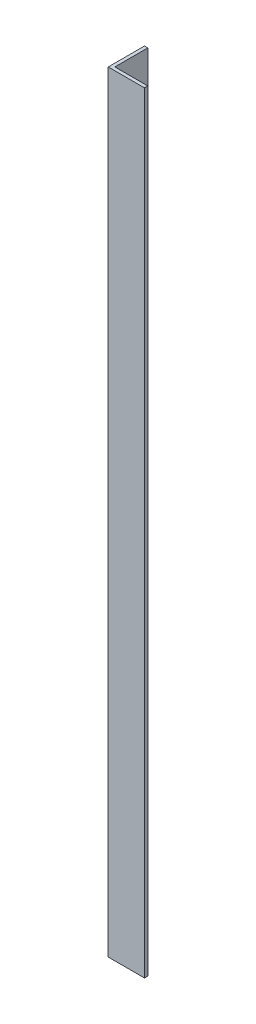
from build123d import *

# Parameters (mm, degrees)
EXTRUDE_START   = 40
EXTRUDE_1_DEPTH = 468


with BuildPart() as part:
    # Эскиз1 → Вытянуть1 (new body)
    with BuildSketch(Plane(origin=(0, 0, 0), x_dir=(1, 0, 0), z_dir=(0, 1, 0)).offset(EXTRUDE_START)):
        Polygon((0, -1.071873395), (0, -21.071873395), (20, -21.071873395), (20, -23.071873395), (-2, -23.071873395), (-2, -1.071873395), align=None)
    extrude(amount=EXTRUDE_1_DEPTH)


solid = part.part
